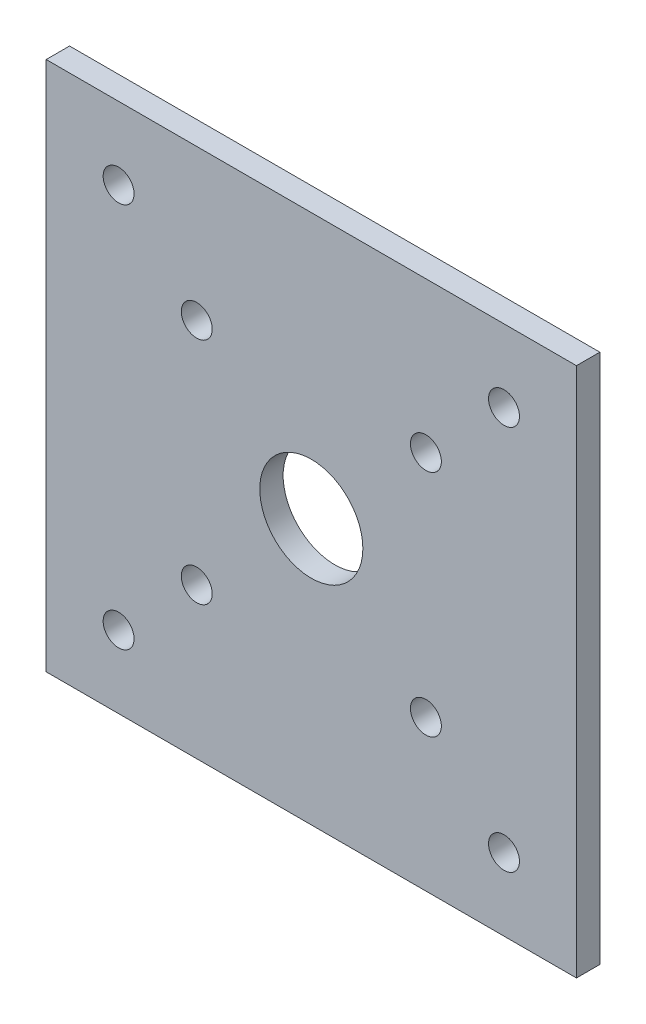
from build123d import *

# Parameters (mm, degrees)
SKETCH1_W           = 72
SKETCH1_H           = 72
SKETCH1_R           = 2.1
SKETCH1_R_2         = 7
BOSS_EXTRUDE1_DEPTH = 1.5875


with BuildPart() as part:
    # Sketch1 → Boss-Extrude1 (new, symmetric)
    with BuildSketch(Plane.XY):
        Rectangle(SKETCH1_W, SKETCH1_H)
        with Locations((-15.556349186, 15.556349186)):
            Circle(SKETCH1_R, mode=Mode.SUBTRACT)
        with Locations((15.556349186, 15.556349186)):
            Circle(SKETCH1_R, mode=Mode.SUBTRACT)
        with Locations((15.556349186, -15.556349186)):
            Circle(SKETCH1_R, mode=Mode.SUBTRACT)
        with Locations((-15.556349186, -15.556349186)):
            Circle(SKETCH1_R, mode=Mode.SUBTRACT)
        with Locations((26.162950904, 26.162950904)):
            Circle(SKETCH1_R, mode=Mode.SUBTRACT)
        with Locations((26.162950904, -26.162950904)):
            Circle(SKETCH1_R, mode=Mode.SUBTRACT)
        with Locations((-26.162950904, -26.162950904)):
            Circle(SKETCH1_R, mode=Mode.SUBTRACT)
        with Locations((-26.162950904, 26.162950904)):
            Circle(SKETCH1_R, mode=Mode.SUBTRACT)
        Circle(SKETCH1_R_2, mode=Mode.SUBTRACT)
    extrude(amount=BOSS_EXTRUDE1_DEPTH, both=True)


solid = part.part
